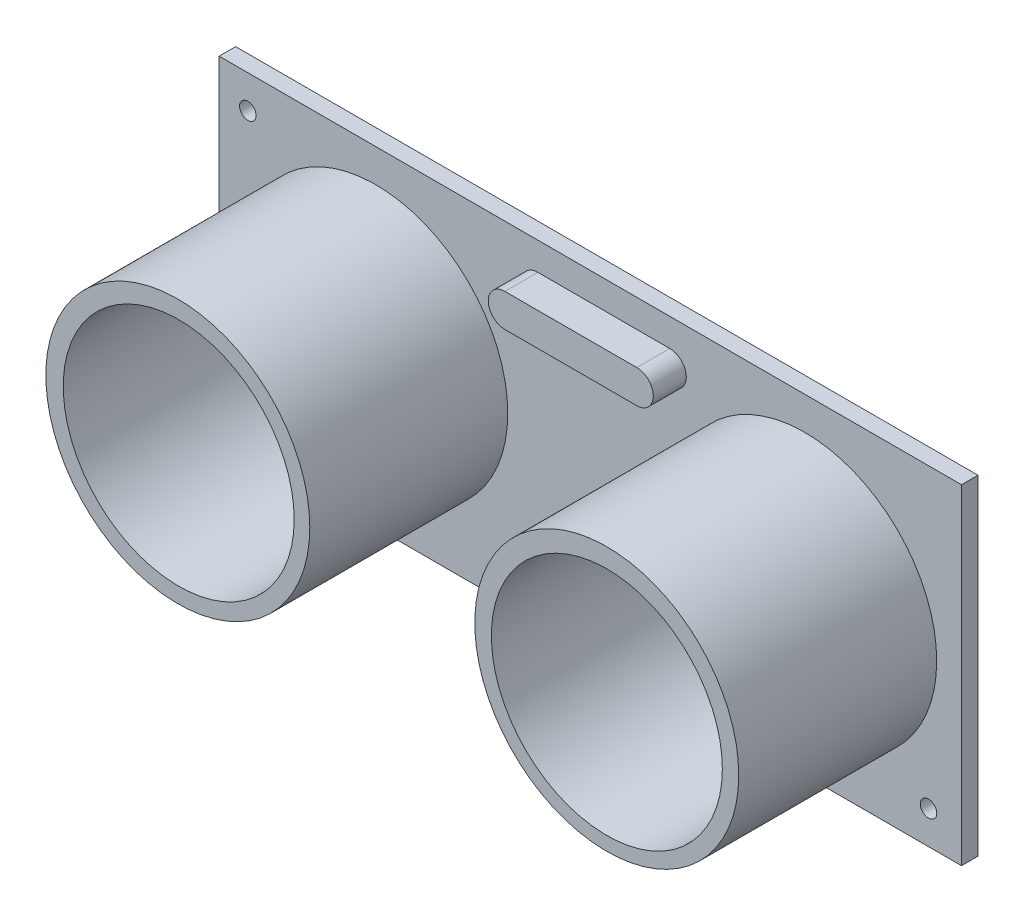
from build123d import *

# Parameters (mm, degrees)
SKETCH1_W           = 45
SKETCH1_H           = 20
BOSS_EXTRUDE1_DEPTH = 1
SKETCH2_R           = 8
SKETCH2_R_2         = 7
BOSS_EXTRUDE2_DEPTH = 12
BOSS_EXTRUDE3_DEPTH = 2
SKETCH5_R           = 1
SKETCH5_R_2         = 0.915040835
BOSS_EXTRUDE4_DEPTH = 1
SKETCH6_R           = 0.5
CUT_EXTRUDE1_DEPTH  = 1


with BuildPart() as part:
    # Sketch1 → Boss-Extrude1 (new body)
    with BuildSketch(Plane.XY):
        with Locations((0.550271739, 0.394021739)):
            Rectangle(SKETCH1_W, SKETCH1_H)
    extrude(amount=BOSS_EXTRUDE1_DEPTH)

    # Sketch2 → Boss-Extrude2 (add)
    # profile 1 of 2: a face of its own
    with BuildSketch(Plane.XY.offset(1)):
        with Locations((-12.452884101, 0.394021739)):
            Circle(SKETCH2_R)
        with Locations((-12.398133971, 0.339271609)):
            Circle(SKETCH2_R_2, mode=Mode.SUBTRACT)
    # profile 2 of 2: a face of its own
    with BuildSketch(Plane.XY.offset(1)):
        with Locations((13.547115899, 0.394021739)):
            Circle(SKETCH2_R)
        with Locations((13.55342758, 0.22977135)):
            Circle(SKETCH2_R_2, mode=Mode.SUBTRACT)
    extrude(amount=BOSS_EXTRUDE2_DEPTH)

    # Sketch4 → Boss-Extrude3 (add)
    with BuildSketch(Plane.XY.offset(1)):
        with BuildLine():
            Line((-2.6309647, 8.704551111), (5.3690353, 8.704551111))
            ThreePointArc((5.3690353, 8.704551111), (6.3690353, 7.704551111), (5.3690353, 6.704551111))
            Line((5.3690353, 6.704551111), (-2.6309647, 6.704551111))
            ThreePointArc((-2.6309647, 6.704551111), (-3.6309647, 7.704551111), (-2.6309647, 8.704551111))
        make_face()
    extrude(amount=BOSS_EXTRUDE3_DEPTH)

    # Sketch5 → Boss-Extrude4 (add)
    with BuildSketch(Plane.XY.offset(1)):
        with Locations((-3.619683348, -7.600525734)):
            Circle(SKETCH5_R)
        with Locations((-1.119683348, -7.600525734)):
            Circle(SKETCH5_R)
        with Locations((1.380316652, -7.600525734)):
            Circle(SKETCH5_R)
        with Locations((3.880316652, -7.600525734)):
            Circle(SKETCH5_R_2)
    extrude(amount=BOSS_EXTRUDE4_DEPTH)

    # Sketch6 → Cut-Extrude1 (cut)
    with BuildSketch(Plane.XY.offset(1)):
        with Locations((-20.209689263, 8.394021739)):
            Circle(SKETCH6_R)
        with Locations((21.050271739, -7.605978261)):
            Circle(SKETCH6_R)
    extrude(amount=-CUT_EXTRUDE1_DEPTH, mode=Mode.SUBTRACT)


solid = part.part
